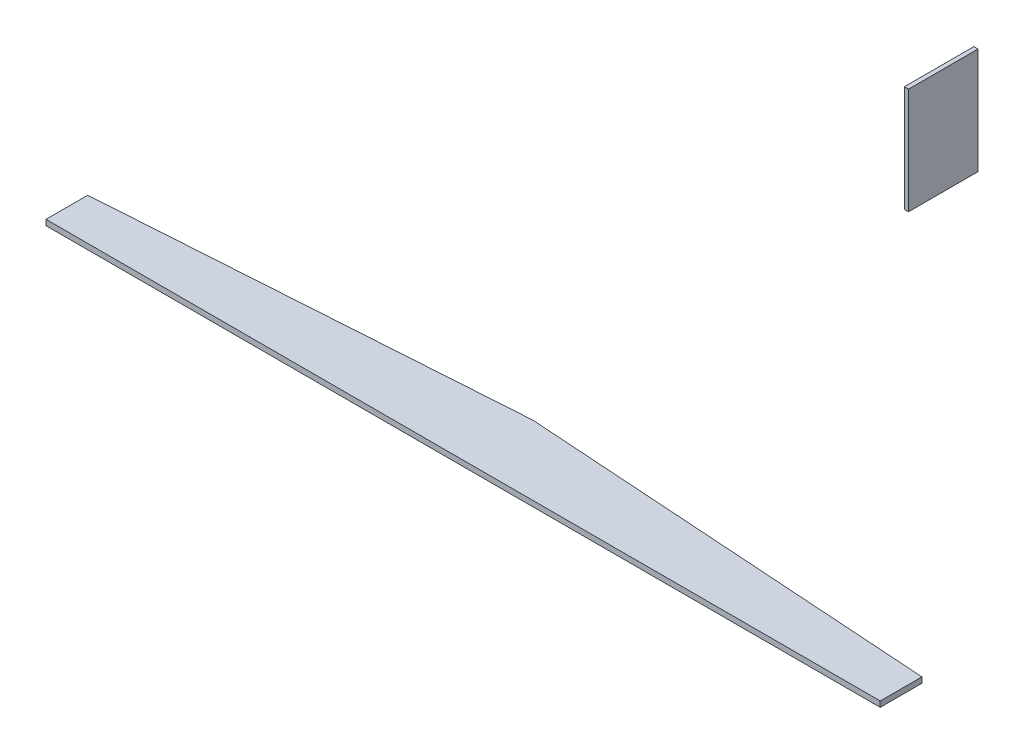
from build123d import *

# Parameters (mm, degrees)
BOSS_EXTRUDE3_DEPTH = 20
SKETCH3_W           = 15
SKETCH3_H           = 250
BOSS_EXTRUDE4_DEPTH = 382


with BuildPart() as part:
    # Sketch2 → Boss-Extrude3 (new body)
    with BuildSketch(Plane(origin=(0, 0, 0), x_dir=(1, 0, 0), z_dir=(0, 1, 0))):
        Polygon((0, -94.094043726), (-1500, -94.094043726), (-1500, 55.905956274), (0, 155.905956274), align=None)
    boss_extrude3 = extrude(amount=BOSS_EXTRUDE3_DEPTH)

    # Mirror1: Boss-Extrude3 across plane
    add(boss_extrude3.mirror(Plane(origin=(0, 20, 94.094043726), x_dir=(0, 0, 1), z_dir=(-1, 0, 0))))


with BuildPart() as body_2:
    # Sketch3 → Boss-Extrude4 (new body)
    with BuildSketch(Plane(origin=(0, 0, 0), x_dir=(1, 0, 0), z_dir=(0, 1, 0))):
        with Locations((0, 1625)):
            Rectangle(SKETCH3_W, SKETCH3_H)
    extrude(amount=BOSS_EXTRUDE4_DEPTH)


solid = Compound([part.part, body_2.part])
